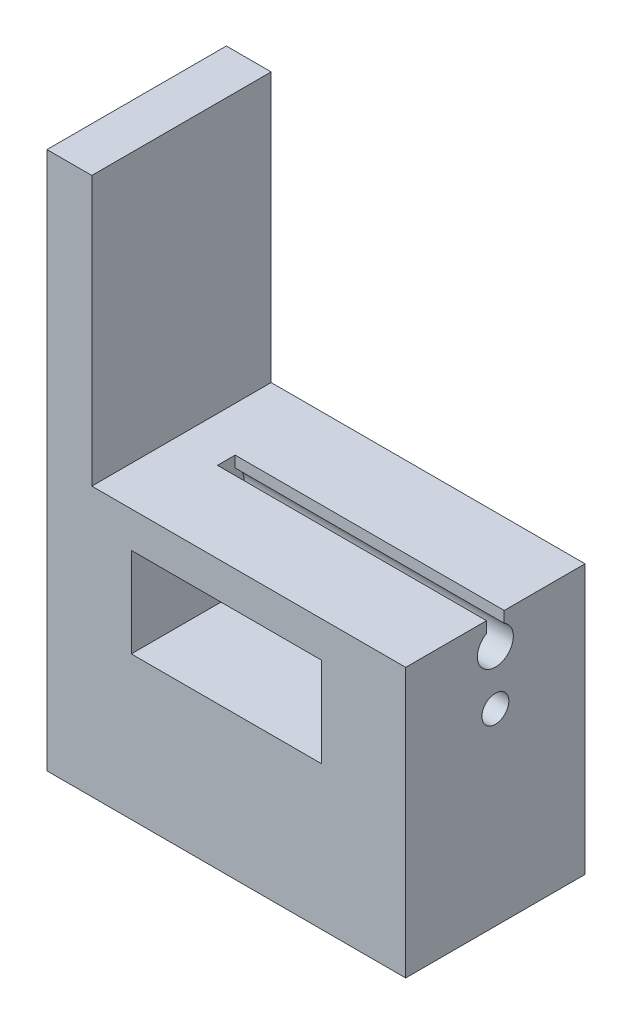
from build123d import *

# Parameters (mm, degrees)
SKETCH1_W               = 50.8
SKETCH1_H               = 25.4
BOSS_EXTRUDE1_DEPTH     = 38.1
CUT_EXTRUDE1_DEPTH      = 53.363441445
CUT_EXTRUDE1_DEPTH_BACK = 53.363441445
SKETCH2_W               = 26.909263032
SKETCH2_H               = 12.7
CUT_EXTRUDE2_DEPTH      = 65.757547823
CUT_EXTRUDE2_DEPTH_BACK = 65.757547823
SKETCH3_R               = 1.905
SKETCH4_W               = 6.35
SKETCH4_H               = 25.4
BOSS_EXTRUDE2_DEPTH     = 38.1
CUT_EXTRUDE3_DEPTH      = 38.1


with BuildPart() as part:
    # Sketch1 → Boss-Extrude1 (new body)
    with BuildSketch(Plane(origin=(0, 0, 0), x_dir=(1, 0, 0), z_dir=(0, 1, 0))):
        Rectangle(SKETCH1_W, SKETCH1_H)
    extrude(amount=BOSS_EXTRUDE1_DEPTH)

    # Sketch2 → Cut-Extrude1 (cut, two sides: drawn at the far end of the back side and taken through both)
    with BuildSketch(Plane.XY.offset(12.7).offset(-CUT_EXTRUDE1_DEPTH_BACK)):
        with Locations((0, 26.67)):
            Rectangle(SKETCH2_W, SKETCH2_H)
    extrude(amount=CUT_EXTRUDE1_DEPTH + CUT_EXTRUDE1_DEPTH_BACK, mode=Mode.SUBTRACT)

    # Sketch3 → Cut-Extrude2 (cut, two sides: drawn at the far end of the back side and taken through both)
    with BuildSketch(Plane.ZY.offset(25.4).offset(-CUT_EXTRUDE2_DEPTH_BACK)):
        with Locations((0, 26.67)):
            Circle(SKETCH3_R)
    extrude(amount=CUT_EXTRUDE2_DEPTH + CUT_EXTRUDE2_DEPTH_BACK, mode=Mode.SUBTRACT)

    # Sketch4 → Boss-Extrude2 (add)
    with BuildSketch(Plane(origin=(0, 38.1, 0), x_dir=(1, 0, 0), z_dir=(0, 1, 0))):
        with Locations((-22.225, 0)):
            Rectangle(SKETCH4_W, SKETCH4_H)
    extrude(amount=BOSS_EXTRUDE2_DEPTH)

    # Sketch5 → Cut-Extrude3 (cut)
    with BuildSketch(Plane(origin=(25.4, 0, 0), x_dir=(0, 0, -1), z_dir=(1, 0, 0))):
        with BuildLine():
            Line((-1.254617423, 38.1), (1.254617423, 38.1))
            Line((1.254617423, 38.1), (1.254617423, 36.523684183))
            ThreePointArc((1.254617423, 36.523684183), (0, 31.773868069), (-1.254617423, 36.523684183))
            Line((-1.254617423, 36.523684183), (-1.254617423, 38.1))
        make_face()
    extrude(amount=-CUT_EXTRUDE3_DEPTH, mode=Mode.SUBTRACT)


solid = part.part
